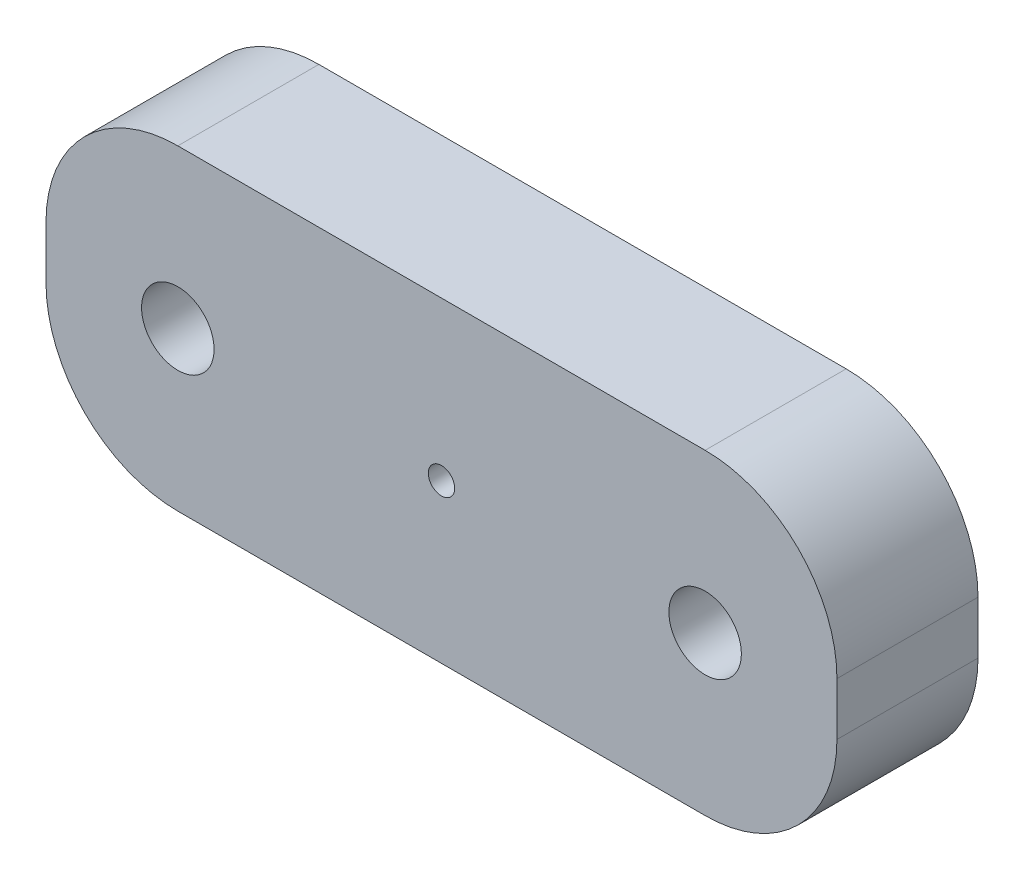
from build123d import *

# Parameters (mm, degrees)
MODEL_R             = 0.5
MODEL_R_2           = 1.375
BOSS_EXTRUDE1_DEPTH = 5.35


with BuildPart() as part:
    # Model → Boss-Extrude1 (new body)
    with BuildSketch(Plane.XY):
        with BuildLine():
            Line((-10, 0), (10, 0))
            ThreePointArc((10, 0), (13.535533906, 1.464466094), (15, 5))
            Line((15, 5), (15, 7))
            ThreePointArc((15, 7), (13.535533906, 10.535533906), (10, 12))
            Line((10, 12), (-10, 12))
            ThreePointArc((-10, 12), (-13.535533906, 10.535533906), (-15, 7))
            Line((-15, 7), (-15, 5))
            ThreePointArc((-15, 5), (-13.535533906, 1.464466094), (-10, 0))
        make_face()
        with Locations((0, 6)):
            Circle(MODEL_R, mode=Mode.SUBTRACT)
        with Locations((-10, 6)):
            Circle(MODEL_R_2, mode=Mode.SUBTRACT)
        with Locations((10, 6)):
            Circle(MODEL_R_2, mode=Mode.SUBTRACT)
    extrude(amount=BOSS_EXTRUDE1_DEPTH)


solid = part.part
